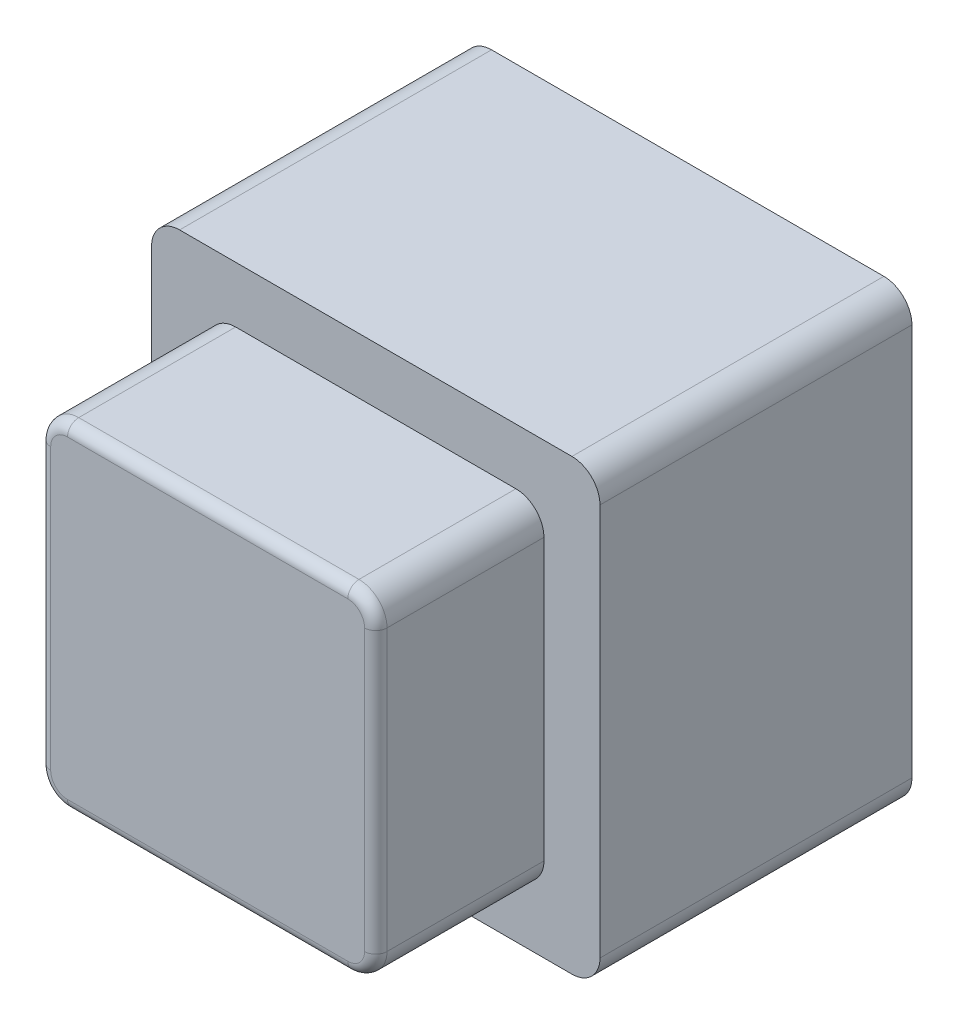
from build123d import *

# Parameters (mm, degrees)
BOSS_EXTRU_1_DEPTH = 3
CONG_1_R           = 0.2
BOSS_EXTRU_2_DEPTH = 5.565397746


with BuildPart() as part:
    # Esquisse1 → Boss.-Extru.1 (new body)
    with BuildSketch(Plane.XY):
        with BuildLine():
            Line((-2.5, -3), (2.5, -3))
            ThreePointArc((2.5, -3), (2.853553391, -2.853553391), (3, -2.5))
            Line((3, -2.5), (3, 2.5))
            ThreePointArc((3, 2.5), (2.853553391, 2.853553391), (2.5, 3))
            Line((2.5, 3), (-2.5, 3))
            ThreePointArc((-2.5, 3), (-2.853553391, 2.853553391), (-3, 2.5))
            Line((-3, 2.5), (-3, -2.5))
            ThreePointArc((-3, -2.5), (-2.853553391, -2.853553391), (-2.5, -3))
        make_face()
    extrude(amount=BOSS_EXTRU_1_DEPTH)

    # Congé1
    cong_1_edges = [part.edges().sort_by_distance(p)[0] for p in [
        (2.853553391, -2.853553391, 3),
        (3, 0, 3),
        (2.853553391, 2.853553391, 3),
        (0, 3, 3),
        (-2.853553391, 2.853553391, 3),
        (-3, 0, 3),
        (-2.853553391, -2.853553391, 3),
        (0, -3, 3),
    ]]
    fillet(cong_1_edges, radius=CONG_1_R)

    # Esquisse2 → Boss.-Extru.2 (add)
    with BuildSketch(Plane.XY):
        with BuildLine():
            Line((-3.5, -4), (3.5, -4))
            ThreePointArc((3.5, -4), (3.853553391, -3.853553391), (4, -3.5))
            Line((4, -3.5), (4, 3.5))
            ThreePointArc((4, 3.5), (3.853553391, 3.853553391), (3.5, 4))
            Line((3.5, 4), (-3.5, 4))
            ThreePointArc((-3.5, 4), (-3.853553391, 3.853553391), (-4, 3.5))
            Line((-4, 3.5), (-4, -3.5))
            ThreePointArc((-4, -3.5), (-3.853553391, -3.853553391), (-3.5, -4))
        make_face()
    extrude(amount=-BOSS_EXTRU_2_DEPTH)


solid = part.part
